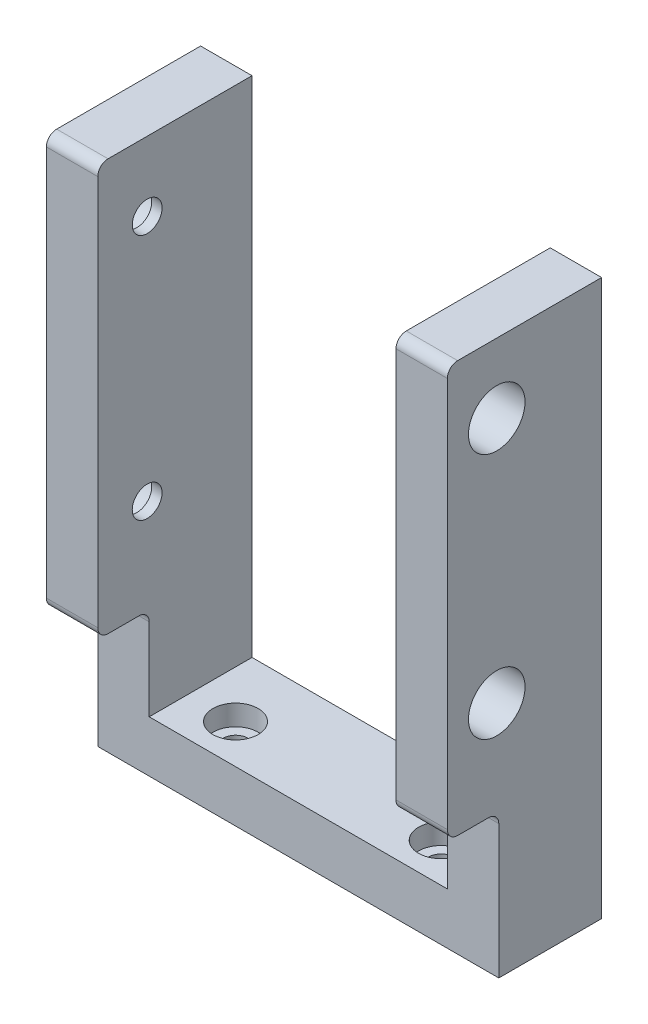
from build123d import *

# Parameters (mm, degrees)
BOSS_EXTRUDE1_DEPTH              = 10
SKETCH2_W                        = 5
SKETCH2_H                        = 40
BOSS_EXTRUDE2_DEPTH              = 5
CBORE_FOR_M2_SHCS1_D             = 2.4
CBORE_FOR_M2_SHCS1_CBORE_D       = 4.4
CBORE_FOR_M2_SHCS1_CBORE_DEPTH   = 2
CBORE_FOR_M2_5_SHCS1_D           = 2.9
CBORE_FOR_M2_5_SHCS1_DEPTH       = 5
CBORE_FOR_M2_5_SHCS1_CBORE_D     = 5.5
CBORE_FOR_M2_5_SHCS1_CBORE_DEPTH = 4
CBORE_FOR_M2_5_SHCS2_D           = 2.9
CBORE_FOR_M2_5_SHCS2_CBORE_D     = 5.5
CBORE_FOR_M2_5_SHCS2_CBORE_DEPTH = 4
FILLET1_R                        = 1


with BuildPart() as part:
    # Sketch1 → Boss-Extrude1 (new body)
    with BuildSketch(Plane.XY):
        Polygon((0, 0), (0, 49), (-5, 49), (-5, -5), (34, -5), (34, 49), (29, 49), (29, 0), align=None)
    extrude(amount=BOSS_EXTRUDE1_DEPTH)

    # Sketch2 → Boss-Extrude2 (add)
    with BuildSketch(Plane.XY.offset(10)):
        with Locations((-2.5, 29)):
            Rectangle(SKETCH2_W, SKETCH2_H)
    boss_extrude2 = extrude(amount=BOSS_EXTRUDE2_DEPTH)

    # Mirror1: Boss-Extrude2 across plane
    add(boss_extrude2.mirror(Plane.ZY.offset(-14.5)))

    # CBORE for M2 SHCS1 (through all)
    with Locations(Plane(origin=(0, 0, 0), x_dir=(1, 0, 0), z_dir=(0, 1, 0))):
        with Locations((24.59562556, -6.2), (4.59562556, -6.2)):
            CounterBoreHole(CBORE_FOR_M2_SHCS1_D / 2, CBORE_FOR_M2_SHCS1_CBORE_D / 2, CBORE_FOR_M2_SHCS1_CBORE_DEPTH)

    # CBORE for M2.5 SHCS1
    with Locations(Plane(origin=(34, 0, 0), x_dir=(0, 0, -1), z_dir=(1, 0, 0))):
        with Locations((-10.2, 42.25), (-10.2, 18.25)):
            CounterBoreHole(CBORE_FOR_M2_5_SHCS1_D / 2, CBORE_FOR_M2_5_SHCS1_CBORE_D / 2, CBORE_FOR_M2_5_SHCS1_CBORE_DEPTH, depth=CBORE_FOR_M2_5_SHCS1_DEPTH)

    # CBORE for M2.5 SHCS2 (through all)
    with Locations(Plane.ZY.offset(5)):
        with Locations((10.2, 42.25), (10.2, 18.25)):
            CounterBoreHole(CBORE_FOR_M2_5_SHCS2_D / 2, CBORE_FOR_M2_5_SHCS2_CBORE_D / 2, CBORE_FOR_M2_5_SHCS2_CBORE_DEPTH)

    # Fillet1
    fillet1_edges = [part.edges().sort_by_distance(p)[0] for p in [
        (-2.5, 9, 10),
        (-2.5, 9, 15),
        (-2.5, 49, 15),
        (31.5, 49, 15),
        (31.5, 9, 15),
        (31.5, 9, 10),
    ]]
    fillet(fillet1_edges, radius=FILLET1_R)


solid = part.part
